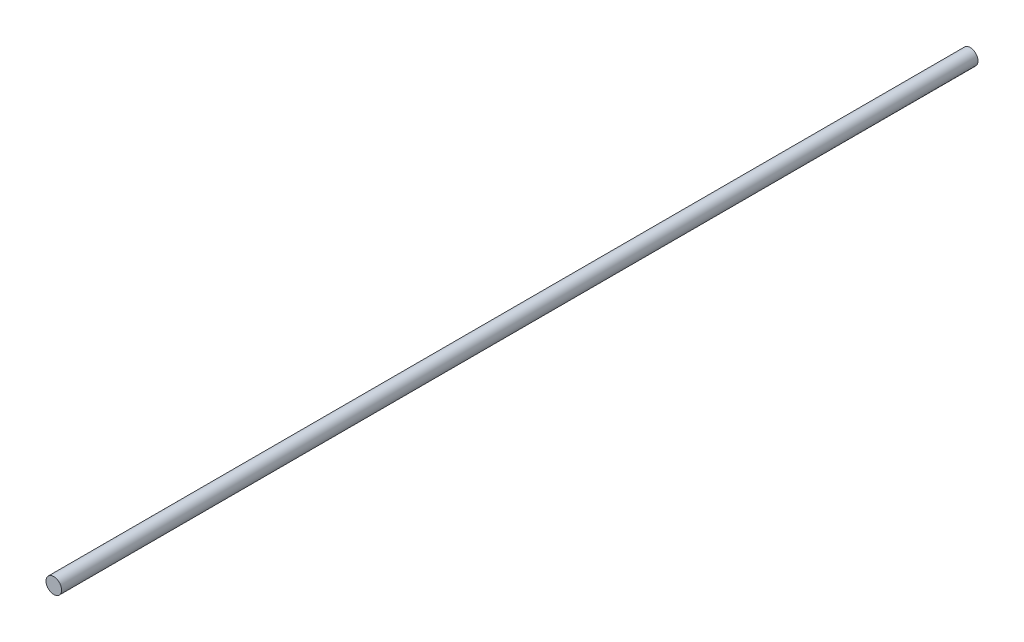
from build123d import *

# Parameters (mm, degrees)
SKETCH1_R           = 2.5
BOSS_EXTRUDE1_DEPTH = 293.82


with BuildPart() as part:
    # Sketch1 → Boss-Extrude1 (new body)
    with BuildSketch(Plane.XY):
        Circle(SKETCH1_R)
    extrude(amount=BOSS_EXTRUDE1_DEPTH)


solid = part.part
